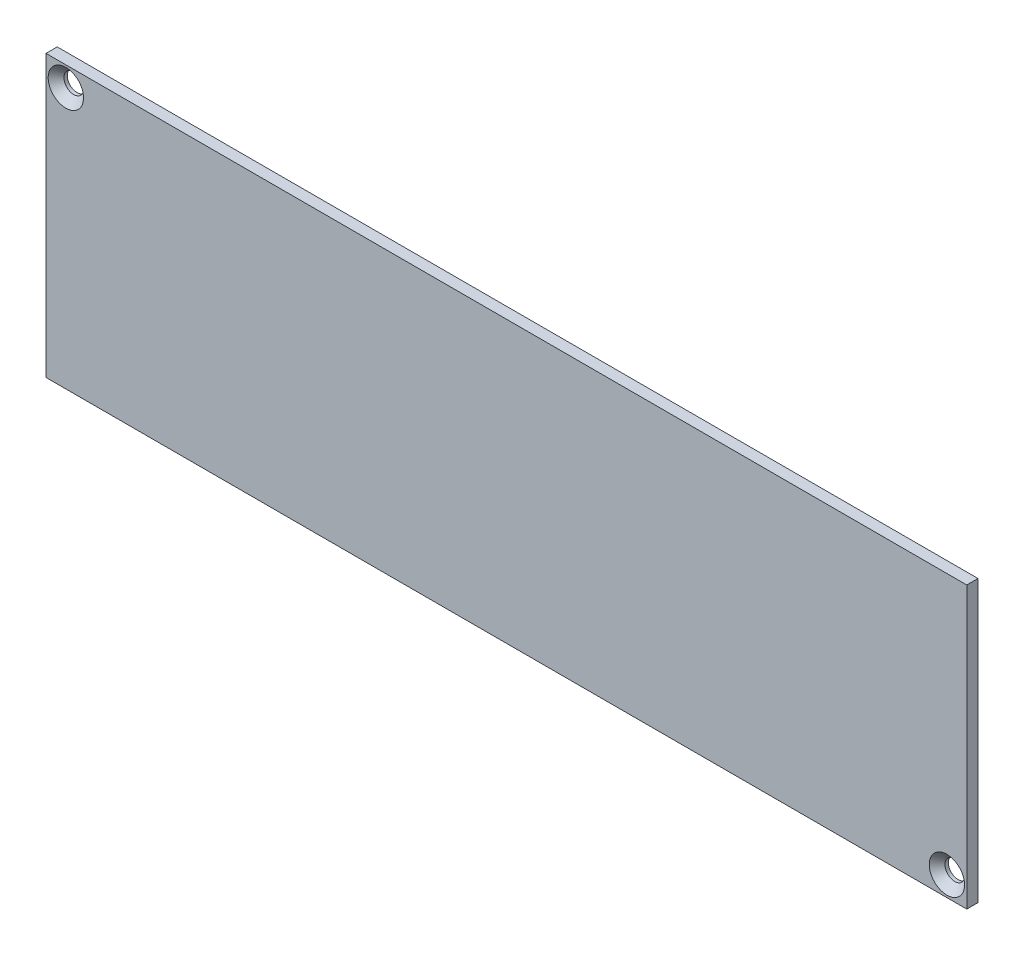
from build123d import *

# Parameters (mm, degrees)
SKETCH1_R                                      = 1.75
BOSS_EXTRUDE1_DEPTH                            = 2
CSK_FOR_M3_FLAT_HEAD_MACHINE_SCREW1_AT_2_COUNT = 2
CSK_FOR_M3_FLAT_HEAD_MACHINE_SCREW1_AT_2_PITCH = 162.694753992


with BuildPart() as part:
    # Sketch1 → Boss-Extrude1 (new body)
    with BuildSketch(Plane.XY):
        Polygon((82, 14), (82, 25), (-82, 25), (-82, -25), (82, -25), (82, -14), align=None)
        with Locations((78.464466094, -21.464466094)):
            Circle(SKETCH1_R, mode=Mode.SUBTRACT)
        with Locations((-78.464466094, 21.464466094)):
            Circle(SKETCH1_R, mode=Mode.SUBTRACT)
    extrude(amount=BOSS_EXTRUDE1_DEPTH)

    # Sketch2 → CSK for M3 Flat Head Machine Screw1 (revolve, cut)
    with BuildSketch(Plane(origin=(-78.464466094, 21.464466094, 2), x_dir=(0, -1, 0), z_dir=(1, 0, 0))):
        Polygon((0, 0), (0, 2), (1.7, 2), (1.7, 1.45), (3.15, 0), align=None)
    csk_for_m3_flat_head_machine_screw1 = revolve(axis=Axis((-78.464466094, 21.464466094, 8.35), (0, 0, -1)), mode=Mode.SUBTRACT)

    # CSK for M3 Flat Head Machine Screw1 at 2: CSK for M3 Flat Head Machine Screw1 ×2
    with Locations(*[Vector(0.9645604934246289, -0.26386180952240207, 0) * (i * CSK_FOR_M3_FLAT_HEAD_MACHINE_SCREW1_AT_2_PITCH) for i in range(1, CSK_FOR_M3_FLAT_HEAD_MACHINE_SCREW1_AT_2_COUNT)]):
        add(csk_for_m3_flat_head_machine_screw1, mode=Mode.SUBTRACT)


solid = part.part
